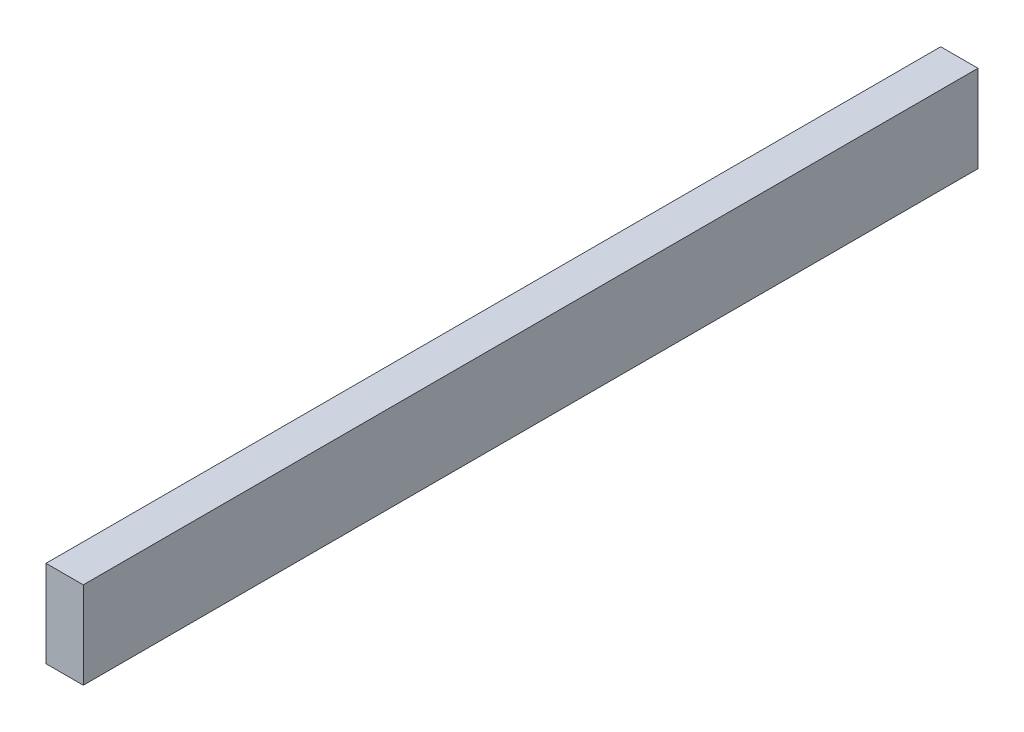
from build123d import *

# Parameters (mm, degrees)
SKETCH1_W           = 38.1
SKETCH1_H           = 88.9
BOSS_EXTRUDE1_DEPTH = 914.4


with BuildPart() as part:
    # Sketch1 → Boss-Extrude1 (new body)
    with BuildSketch(Plane.XY):
        with Locations((44.45, 1104.9)):
            Rectangle(SKETCH1_W, SKETCH1_H)
    extrude(amount=BOSS_EXTRUDE1_DEPTH)


solid = part.part
